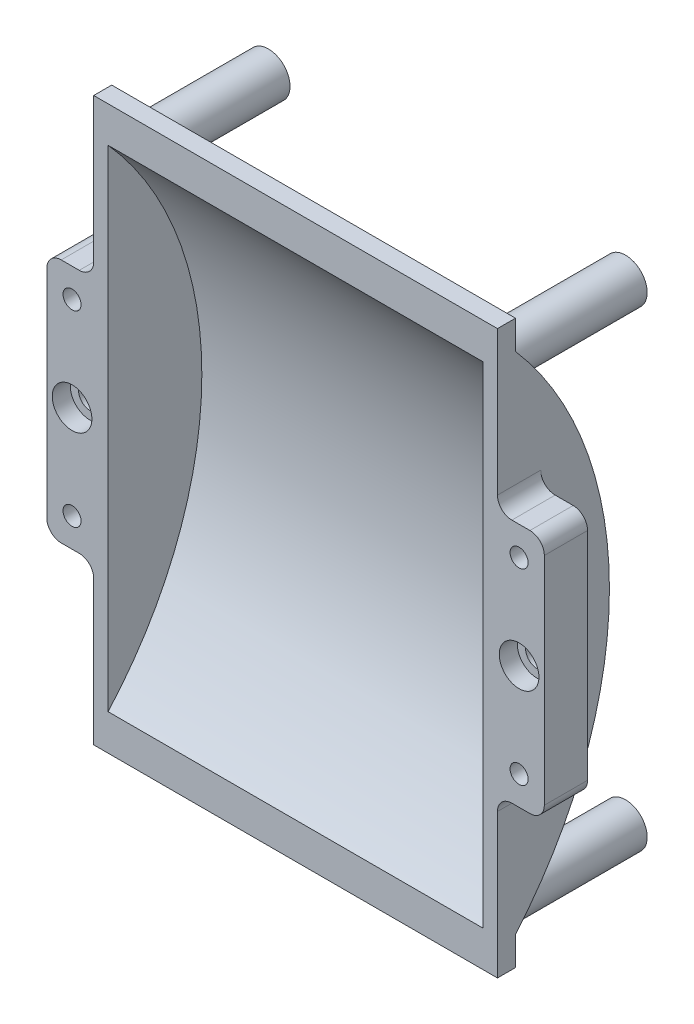
from build123d import *

# Parameters (mm, degrees)
EXTRUDE_1_DEPTH     = 26
EXTRUDE_START       = 2
EXTRUDE_2_DEPTH     = 2
EXTRUDE_3_DEPTH     = 2
SKETCH_7_W          = 6.5
SKETCH_7_H          = 34
SKETCH_7_R          = 1.6
SKETCH_7_R_2        = 1.25
EXTRUDE_4_DEPTH     = 6
FILLET_1_R          = 2
EXTRUDE_5_REACH     = 58.145
SKETCH_9_R          = 3
SKETCH_9_R_2        = 1.35
SKETCH_10_R         = 2.75
CUT_EXTRUDE_1_DEPTH = 2.5
CUT_EXTRUDE_4_DEPTH = 26


with BuildPart() as part:
    # 草图2 → 凸台-拉伸1 (new, symmetric)
    with BuildSketch(Plane(origin=(0, 0, 0), x_dir=(0, 0, -1), z_dir=(1, 0, 0))):
        with BuildLine():
            Line((0, 34.014702703), (0, 39))
            Line((0, 39), (2.5, 39))
            Line((2.5, 39), (2.5, 35))
            ThreePointArc((2.5, 35), (15.52803004, 0), (2.5, -35))
            Line((2.5, -35), (2.5, -39))
            Line((2.5, -39), (0, -39))
            Line((0, -39), (0, -34.014702703))
            ThreePointArc((0, -34.014702703), (13, 0), (0, 34.014702703))
        make_face()
    extrude(amount=EXTRUDE_1_DEPTH, both=True)

    # 草图3 → 凸台-拉伸2 (add)
    with BuildSketch(Plane(origin=(26, 0, 0), x_dir=(0, 0, -1), z_dir=(1, 0, 0)).offset(EXTRUDE_START)):
        with BuildLine():
            Line((0, 39), (0, -39))
            Line((0, -39), (2.5, -39))
            Line((2.5, -39), (2.5, -35))
            ThreePointArc((2.5, -35), (15.52803004, 0), (2.5, 35))
            Line((2.5, 35), (2.5, 39))
            Line((2.5, 39), (0, 39))
        make_face()
    extrude(amount=-EXTRUDE_2_DEPTH)

    # 草图4 → 凸台-拉伸3 (add)
    with BuildSketch(Plane.ZY.offset(26)):
        with BuildLine():
            Line((-2.5, 35), (-2.5, 39))
            Line((-2.5, 39), (0, 39))
            Line((0, 39), (0, -39))
            Line((0, -39), (-2.5, -39))
            Line((-2.5, -39), (-2.5, -35))
            ThreePointArc((-2.5, -35), (-15.52803004, 0), (-2.5, 35))
        make_face()
    extrude(amount=EXTRUDE_3_DEPTH)

    # 草图7 → 凸台-拉伸4 (add)
    # profile 1 of 2: a face of its own
    with BuildSketch(Plane.XY):
        with Locations((31.25, 0)):
            Rectangle(SKETCH_7_W, SKETCH_7_H)
        with Locations((31, 0)):
            Circle(SKETCH_7_R, mode=Mode.SUBTRACT)
        with Locations((31, 13)):
            Circle(SKETCH_7_R_2, mode=Mode.SUBTRACT)
        with Locations(Location((31, -13, 0), (0, 0, 180))):
            Circle(SKETCH_7_R_2, mode=Mode.SUBTRACT)
    # profile 2 of 2: a face of its own
    with BuildSketch(Plane.XY):
        with Locations((-31.25, 0)):
            Rectangle(SKETCH_7_W, SKETCH_7_H)
        with Locations((-31, -13)):
            Circle(SKETCH_7_R_2, mode=Mode.SUBTRACT)
        with Locations(Location((-31, 0, 0), (0, 0, 180))):
            Circle(SKETCH_7_R, mode=Mode.SUBTRACT)
        with Locations(Location((-31, 13, 0), (0, 0, 180))):
            Circle(SKETCH_7_R_2, mode=Mode.SUBTRACT)
    extrude(amount=-EXTRUDE_4_DEPTH)

    # 圆角1
    fillet_1_edges = [part.edges().sort_by_distance(p)[0] for p in [
        (28, -17, -3),
        (28, 17, -3),
        (34.5, 17, -3),
        (34.5, -17, -3),
        (-34.5, -17, -3),
        (-34.5, 17, -3),
        (-28, 17, -3),
        (-28, -17, -3),
    ]]
    fillet(fillet_1_edges, radius=FILLET_1_R)

    # 凸台-拉伸5: up to this face of the body (flat: up to its plane)
    extrude_5_end = Plane(part.part.faces().sort_by_distance((0, 37, -2.5))[0])
    # 草图9 → 凸台-拉伸5 (add, up to the picked face)
    with BuildSketch(Plane.XY.offset(-21), mode=Mode.PRIVATE) as extrude_5_sk1:
        with Locations(Location((-24.765, 32.705, 0), (0, 0, 130.093007985))):
            Circle(SKETCH_9_R)
        with Locations(Location((-24.765, 32.705, 0), (0, 0, 180))):
            Circle(SKETCH_9_R_2, mode=Mode.SUBTRACT)
    extrude_5_tool1 = split(extrude(extrude_5_sk1.sketch, amount=EXTRUDE_5_REACH, mode=Mode.PRIVATE), bisect_by=extrude_5_end, keep=Keep.BOTH, mode=Mode.PRIVATE)
    # 草图9 → 凸台-拉伸5 (add, up to the picked face)
    with BuildSketch(Plane.XY.offset(-21), mode=Mode.PRIVATE) as extrude_5_sk2:
        with Locations(Location((24.765, 32.705, 0), (0, 0, 180))):
            Circle(SKETCH_9_R)
        with Locations(Location((24.765, 32.705, 0), (0, 0, 180))):
            Circle(SKETCH_9_R_2, mode=Mode.SUBTRACT)
    extrude_5_tool2 = split(extrude(extrude_5_sk2.sketch, amount=EXTRUDE_5_REACH, mode=Mode.PRIVATE), bisect_by=extrude_5_end, keep=Keep.BOTH, mode=Mode.PRIVATE)
    # 草图9 → 凸台-拉伸5 (add, up to the picked face)
    with BuildSketch(Plane.XY.offset(-21), mode=Mode.PRIVATE) as extrude_5_sk3:
        with Locations(Location((24.765, -32.705, 0), (0, 0, 229.906992015))):
            Circle(SKETCH_9_R)
        with Locations(Location((24.765, -32.705, 0), (0, 0, 180))):
            Circle(SKETCH_9_R_2, mode=Mode.SUBTRACT)
    extrude_5_tool3 = split(extrude(extrude_5_sk3.sketch, amount=EXTRUDE_5_REACH, mode=Mode.PRIVATE), bisect_by=extrude_5_end, keep=Keep.BOTH, mode=Mode.PRIVATE)
    # 草图9 → 凸台-拉伸5 (add, up to the picked face)
    with BuildSketch(Plane.XY.offset(-21), mode=Mode.PRIVATE) as extrude_5_sk4:
        with Locations(Location((-24.765, -32.705, 0), (0, 0, 180))):
            Circle(SKETCH_9_R)
        with Locations(Location((-24.765, -32.705, 0), (0, 0, 180))):
            Circle(SKETCH_9_R_2, mode=Mode.SUBTRACT)
    extrude_5_tool4 = split(extrude(extrude_5_sk4.sketch, amount=EXTRUDE_5_REACH, mode=Mode.PRIVATE), bisect_by=extrude_5_end, keep=Keep.BOTH, mode=Mode.PRIVATE)
    add(extrude_5_tool1.solids().sort_by(Axis((-22.887557, 30.474912, -21), (0, 0, 1)))[0])
    add(extrude_5_tool2.solids().sort_by(Axis((27.680147, 32.705, -21), (0, 0, 1)))[0])
    add(extrude_5_tool3.solids().sort_by(Axis((26.642443, -30.474912, -21), (0, 0, 1)))[0])
    add(extrude_5_tool4.solids().sort_by(Axis((-21.849853, -32.705, -21), (0, 0, 1)))[0])

    # 草图10 → 切除-拉伸1 (cut)
    with BuildSketch(Plane.XY):
        with Locations((-31, 0)):
            Circle(SKETCH_10_R)
        with Locations((31, 0)):
            Circle(SKETCH_10_R)
    extrude(amount=-CUT_EXTRUDE_1_DEPTH, mode=Mode.SUBTRACT)

    # 草图12 → 切除-拉伸4 (cut, symmetric)
    with BuildSketch(Plane(origin=(0, 0, 0), x_dir=(0, 0, -1), z_dir=(1, 0, 0))):
        with BuildLine():
            Line((0, 34.014702703), (0, -34.014702703))
            ThreePointArc((0, -34.014702703), (13, 0), (0, 34.014702703))
        make_face()
    extrude(amount=CUT_EXTRUDE_4_DEPTH, both=True, mode=Mode.SUBTRACT)


solid = part.part
